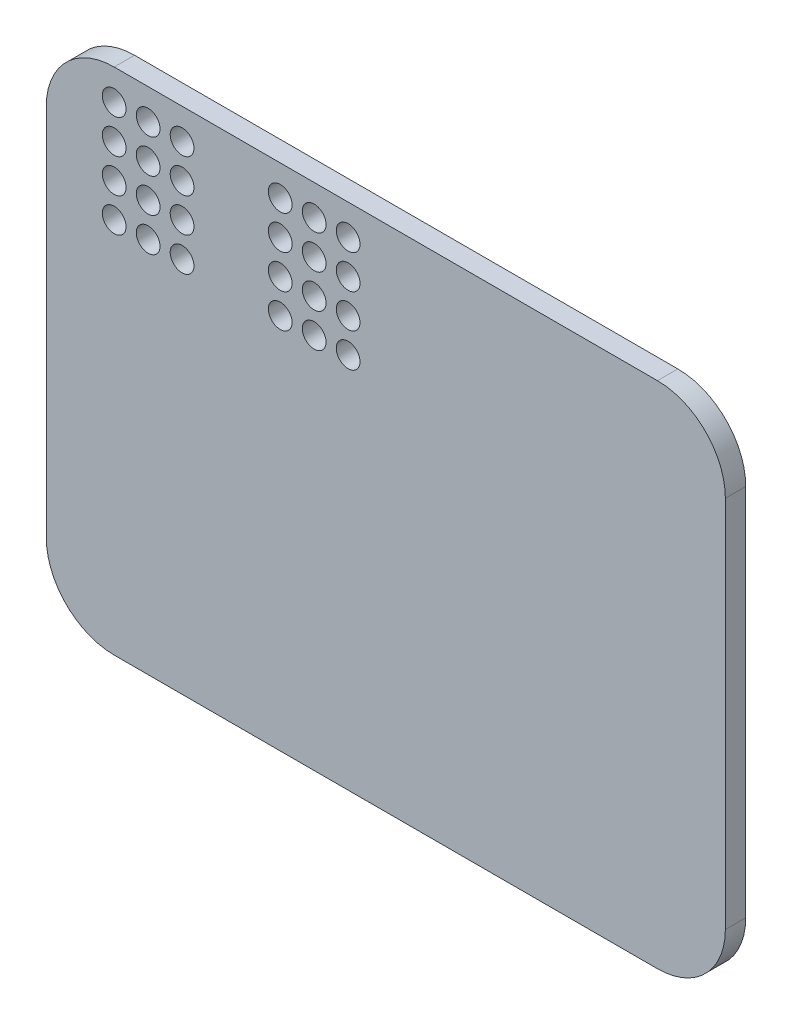
from build123d import *

# Parameters (mm, degrees)
SKETCH1_R           = 1.75
BOSS_EXTRUDE1_DEPTH = 3


with BuildPart() as part:
    # Sketch1 → Boss-Extrude1 (new body)
    with BuildSketch(Plane.XY):
        with BuildLine():
            Line((10, 0), (90, 0))
            ThreePointArc((90, 0), (97.071067812, 2.928932188), (100, 10))
            Line((100, 10), (100, 65))
            ThreePointArc((100, 65), (97.071067812, 72.071067812), (90, 75))
            Line((90, 75), (10, 75))
            ThreePointArc((10, 75), (2.928932188, 72.071067812), (0, 65))
            Line((0, 65), (0, 10))
            ThreePointArc((0, 10), (2.928932188, 2.928932188), (10, 0))
        make_face()
        with Locations((10, 70.5)):
            Circle(SKETCH1_R, mode=Mode.SUBTRACT)
        with Locations((10, 65.5)):
            Circle(SKETCH1_R, mode=Mode.SUBTRACT)
        with Locations((10, 60.5)):
            Circle(SKETCH1_R, mode=Mode.SUBTRACT)
        with Locations((10, 55.5)):
            Circle(SKETCH1_R, mode=Mode.SUBTRACT)
        with Locations((15, 70.5)):
            Circle(SKETCH1_R, mode=Mode.SUBTRACT)
        with Locations((15, 65.5)):
            Circle(SKETCH1_R, mode=Mode.SUBTRACT)
        with Locations((15, 60.5)):
            Circle(SKETCH1_R, mode=Mode.SUBTRACT)
        with Locations((15, 55.5)):
            Circle(SKETCH1_R, mode=Mode.SUBTRACT)
        with Locations((20, 70.5)):
            Circle(SKETCH1_R, mode=Mode.SUBTRACT)
        with Locations((20, 65.5)):
            Circle(SKETCH1_R, mode=Mode.SUBTRACT)
        with Locations((20, 60.5)):
            Circle(SKETCH1_R, mode=Mode.SUBTRACT)
        with Locations((20, 55.5)):
            Circle(SKETCH1_R, mode=Mode.SUBTRACT)
        with Locations((34.45, 70.5)):
            Circle(SKETCH1_R, mode=Mode.SUBTRACT)
        with Locations((39.45, 70.5)):
            Circle(SKETCH1_R, mode=Mode.SUBTRACT)
        with Locations((44.45, 70.5)):
            Circle(SKETCH1_R, mode=Mode.SUBTRACT)
        with Locations((44.45, 65.5)):
            Circle(SKETCH1_R, mode=Mode.SUBTRACT)
        with Locations((39.45, 65.5)):
            Circle(SKETCH1_R, mode=Mode.SUBTRACT)
        with Locations((34.45, 65.5)):
            Circle(SKETCH1_R, mode=Mode.SUBTRACT)
        with Locations((34.45, 60.5)):
            Circle(SKETCH1_R, mode=Mode.SUBTRACT)
        with Locations((39.45, 60.5)):
            Circle(SKETCH1_R, mode=Mode.SUBTRACT)
        with Locations((44.45, 60.5)):
            Circle(SKETCH1_R, mode=Mode.SUBTRACT)
        with Locations((44.45, 55.5)):
            Circle(SKETCH1_R, mode=Mode.SUBTRACT)
        with Locations((39.45, 55.5)):
            Circle(SKETCH1_R, mode=Mode.SUBTRACT)
        with Locations((34.45, 55.5)):
            Circle(SKETCH1_R, mode=Mode.SUBTRACT)
    extrude(amount=BOSS_EXTRUDE1_DEPTH)


solid = part.part
